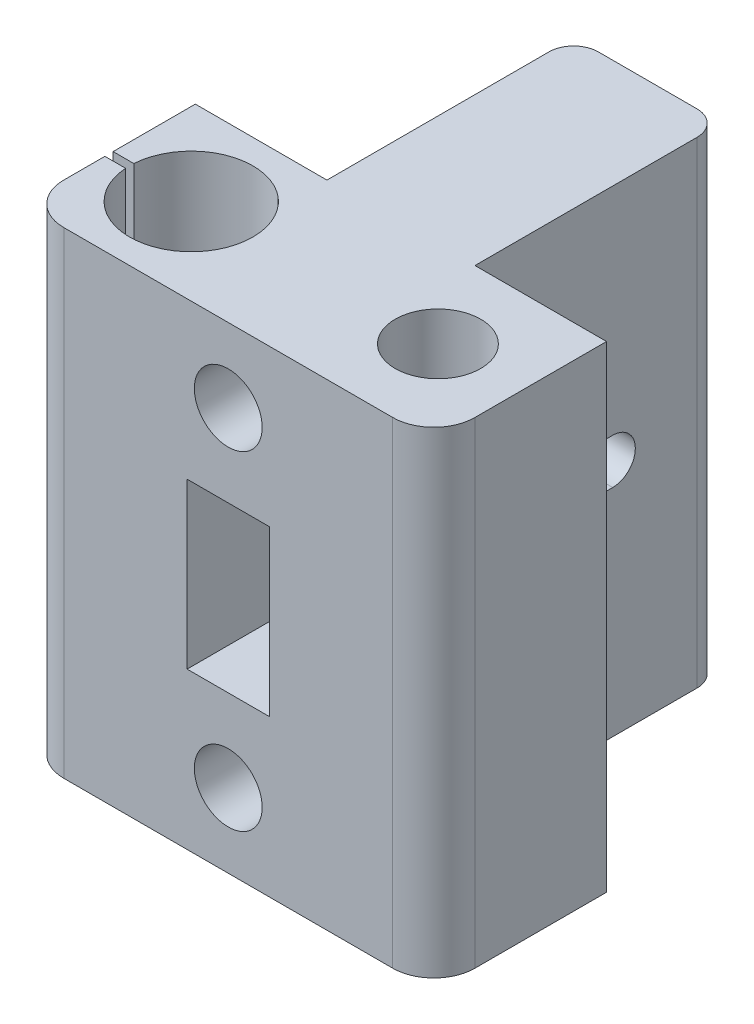
from build123d import *

# Parameters (mm, degrees)
SKETCH1_W           = 50
SKETCH1_H           = 21
BOSS_EXTRUDE1_DEPTH = 58
SKETCH3_R           = 7.5
CUT_EXTRUDE1_DEPTH  = 24
CUT_EXTRUDE2_REACH  = 66.025
SKETCH4_R           = 5.2
CUT_EXTRUDE3_START  = -24
SKETCH5_R           = 7.5
CUT_EXTRUDE3_DEPTH  = 24
CUT_EXTRUDE4_REACH  = 66.025
SKETCH6_R           = 4.5
CUT_EXTRUDE5_REACH  = 68.558
SKETCH8_W           = 10
SKETCH8_H           = 20
SKETCH11_W          = 4
SKETCH11_H          = 20
BOSS_EXTRUDE2_DEPTH = 26
SKETCH12_W          = 18
SKETCH12_H          = 20
BOSS_EXTRUDE3_DEPTH = 4
CUT_EXTRUDE7_DEPTH  = 79.487260113
FILLET1_R           = 5
SKETCH14_R          = 1.95
CUT_EXTRUDE8_DEPTH  = 10
SKETCH15_W          = 5.527864045
SKETCH15_H          = 1
CUT_EXTRUDE9_DEPTH  = 76.028327984
SKETCH17_W          = 30
SKETCH17_H          = 19
BOSS_EXTRUDE5_DEPTH = 18
SKETCH7_R           = 4.125
CUT_EXTRUDE6_DEPTH  = 45
FILLET8_R           = 3
SKETCH18_W          = 6
SKETCH18_H          = 5.5
CUT_EXTRUDE10_DEPTH = 1


with BuildPart() as part:
    # Sketch1 → Boss-Extrude1 (new body)
    with BuildSketch(Plane(origin=(0, 0, 0), x_dir=(1, 0, 0), z_dir=(0, 1, 0))):
        Rectangle(SKETCH1_W, SKETCH1_H)
    extrude(amount=BOSS_EXTRUDE1_DEPTH)

    # Sketch3 → Cut-Extrude1 (cut)
    with BuildSketch(Plane(origin=(0, 58, 0), x_dir=(1, 0, 0), z_dir=(0, 1, 0))):
        with Locations(Location((-15, 0, 0), (0, 0, 270))):
            Circle(SKETCH3_R)
    extrude(amount=-CUT_EXTRUDE1_DEPTH, mode=Mode.SUBTRACT)

    # Sketch4 → Cut-Extrude2 (cut, up to next)
    with BuildSketch(Plane(origin=(0, 58, 0), x_dir=(1, 0, 0), z_dir=(0, 1, 0)), mode=Mode.PRIVATE) as cut_extrude2_sk1:
        with Locations(Location((15, 0, 0), (0, 0, 270))):
            Circle(SKETCH4_R)
    cut_extrude2_tool1 = extrude(cut_extrude2_sk1.sketch, amount=-CUT_EXTRUDE2_REACH, mode=Mode.PRIVATE) & part.part
    add(cut_extrude2_tool1.solids().sort_by_distance((15, 58, 0))[0], mode=Mode.SUBTRACT)

    # Sketch5 → Cut-Extrude3 (cut)
    with BuildSketch(Plane.XZ.offset(CUT_EXTRUDE3_START)):
        with Locations(Location((-15, 0, 0), (0, 0, 90))):
            Circle(SKETCH5_R)
    extrude(amount=CUT_EXTRUDE3_DEPTH, mode=Mode.SUBTRACT)

    # Sketch6 → Cut-Extrude4 (cut, up to next)
    with BuildSketch(Plane.XZ, mode=Mode.PRIVATE) as cut_extrude4_sk1:
        with Locations(Location((-15, 0, 0), (0, 0, 270))):
            Circle(SKETCH6_R)
    cut_extrude4_tool1 = extrude(cut_extrude4_sk1.sketch, amount=-CUT_EXTRUDE4_REACH, mode=Mode.PRIVATE) & part.part
    add(cut_extrude4_tool1.solids().sort_by_distance((-15, 0, 0))[0], mode=Mode.SUBTRACT)

    # Sketch8 → Cut-Extrude5 (cut, up to next)
    with BuildSketch(Plane.XY.offset(10.5), mode=Mode.PRIVATE) as cut_extrude5_sk1:
        with Locations((0, 29)):
            Rectangle(SKETCH8_W, SKETCH8_H)
    cut_extrude5_tool1 = extrude(cut_extrude5_sk1.sketch, amount=-CUT_EXTRUDE5_REACH, mode=Mode.PRIVATE) & part.part
    add(cut_extrude5_tool1.solids().sort_by_distance((0, 29, 10.5))[0], mode=Mode.SUBTRACT)

    # Sketch11 → Boss-Extrude2 (add)
    with BuildSketch(Plane(origin=(0, 0, -10.5), x_dir=(-1, 0, 0), z_dir=(0, 0, -1))):
        with Locations((7, 29)):
            Rectangle(SKETCH11_W, SKETCH11_H)
        with Locations((-7, 29)):
            Rectangle(SKETCH11_W, SKETCH11_H)
    extrude(amount=BOSS_EXTRUDE2_DEPTH)

    # Sketch12 → Boss-Extrude3 (add)
    with BuildSketch(Plane(origin=(0, 0, -36.5), x_dir=(-1, 0, 0), z_dir=(0, 0, -1))):
        with Locations((0, 29)):
            Rectangle(SKETCH12_W, SKETCH12_H)
    extrude(amount=BOSS_EXTRUDE3_DEPTH)

    # Sketch13 → Cut-Extrude7 (cut, through all)
    with BuildSketch(Plane(origin=(9, 0, 0), x_dir=(0, 0, -1), z_dir=(1, 0, 0))):
        with BuildLine():
            Line((18.25, 31.75), (27.25, 31.75))
            ThreePointArc((27.25, 31.75), (30, 29), (27.25, 26.25))
            Line((27.25, 26.25), (18.25, 26.25))
            ThreePointArc((18.25, 26.25), (15.5, 29), (18.25, 31.75))
        make_face()
    extrude(amount=-CUT_EXTRUDE7_DEPTH, mode=Mode.SUBTRACT)

    # Fillet1
    fillet1_edges = [part.edges().sort_by_distance(p)[0] for p in [
        (25, 29, 10.5),
        (-25, 29, 10.5),
    ]]
    fillet(fillet1_edges, radius=FILLET1_R)

    # Sketch14 → Cut-Extrude8 (cut)
    with BuildSketch(Plane.XZ):
        with Locations(Location((20.550788232, 5.550788232, 0), (0, 0, 270))):
            Circle(SKETCH14_R)
        with Locations(Location((9.449211768, -5.550788232, 0), (0, 0, 270))):
            Circle(SKETCH14_R)
    extrude(amount=-CUT_EXTRUDE8_DEPTH, mode=Mode.SUBTRACT)

    # Sketch15 → Cut-Extrude9 (cut, through all)
    with BuildSketch(Plane(origin=(0, 58, 0), x_dir=(1, 0, 0), z_dir=(0, 1, 0))):
        with Locations((-22.236067977, 0)):
            Rectangle(SKETCH15_W, SKETCH15_H)
    extrude(amount=-CUT_EXTRUDE9_DEPTH, mode=Mode.SUBTRACT)

    # Sketch17 → Boss-Extrude5 (add)
    with BuildSketch(Plane(origin=(9, 0, 0), x_dir=(0, 0, -1), z_dir=(1, 0, 0))):
        with Locations((25.5, 48.5)):
            Rectangle(SKETCH17_W, SKETCH17_H)
        with Locations((25.5, 9.5)):
            Rectangle(SKETCH17_W, SKETCH17_H)
    extrude(amount=-BOSS_EXTRUDE5_DEPTH)

    # Sketch7 → Cut-Extrude6 (cut)
    with BuildSketch(Plane.XY.offset(10.5)):
        with Locations((0, 49)):
            Circle(SKETCH7_R)
        with Locations((0, 9)):
            Circle(SKETCH7_R)
    extrude(amount=-CUT_EXTRUDE6_DEPTH, mode=Mode.SUBTRACT)

    # Fillet8
    fillet8_edges = [part.edges().sort_by_distance(p)[0] for p in [
        (-9, 29, -40.5),
        (9, 29, -40.5),
    ]]
    fillet(fillet8_edges, radius=FILLET8_R)

    # Sketch18 → Cut-Extrude10 (cut)
    with BuildSketch(Plane(origin=(0, 0, -40.5), x_dir=(-1, 0, 0), z_dir=(0, 0, -1))):
        with Locations((0, 29)):
            Rectangle(SKETCH18_W, SKETCH18_H)
    extrude(amount=-CUT_EXTRUDE10_DEPTH, mode=Mode.SUBTRACT)


solid = part.part
